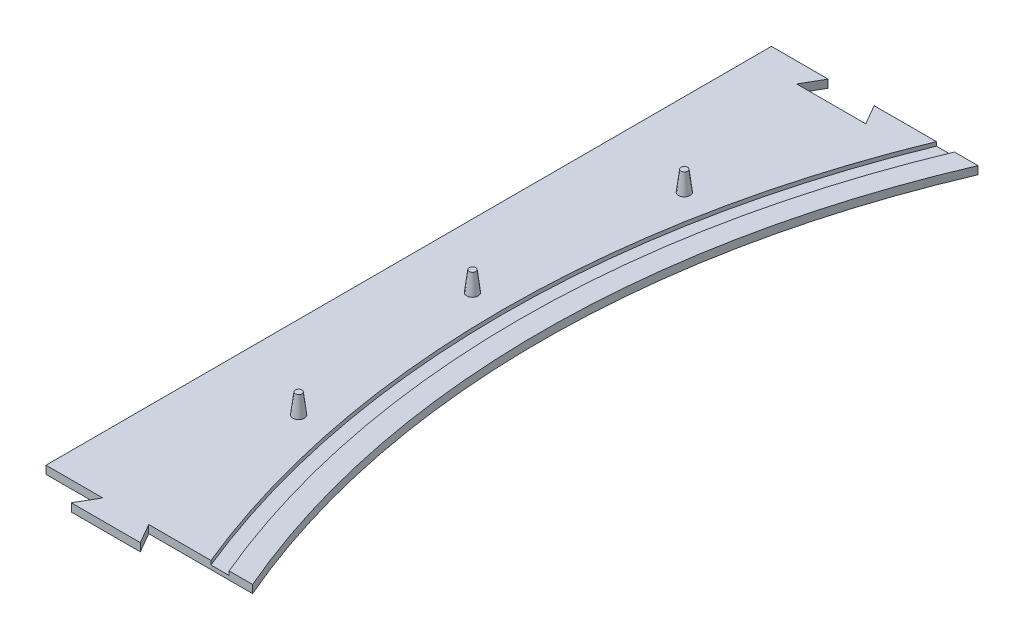
from build123d import *

# Parameters (mm, degrees)
BASEPLATE_PROFILE_DEPTH               = 2
SKETCH2_R                             = 1.45
M3_PINS_DEPTH                         = 5
M3_PINS_TAPER                         = 7
CIRPATTERN1_COUNT                     = 32
SKETCH4_R                             = 1
PILLAR_PINS_DEPTH                     = 5
PILLAR_PINS_DRAFT                     = 6
PILLAR_PINS_PROFILE_2_DEPTH           = 5
PILLAR_PINS_PROFILE_2_DRAFT           = 6
CIRPATTERN2_COPY_1_SKETCH_R           = 1
CIRPATTERN2_COPY_1_DEPTH              = 5
CIRPATTERN2_COPY_1_DRAFT              = 6
CIRPATTERN2_COPY_2_SKETCH_R           = 1
CIRPATTERN2_COPY_2_DEPTH              = 5
CIRPATTERN2_COPY_2_DRAFT              = 6
CIRPATTERN2_COPY_3_SKETCH_R           = 1
CIRPATTERN2_COPY_3_DEPTH              = 5
CIRPATTERN2_COPY_3_DRAFT              = 6
CIRPATTERN2_COPY_4_SKETCH_R           = 1
CIRPATTERN2_COPY_4_DEPTH              = 5
CIRPATTERN2_COPY_4_DRAFT              = 6
CIRPATTERN2_COPY_5_SKETCH_R           = 1
CIRPATTERN2_COPY_5_DEPTH              = 5
CIRPATTERN2_COPY_5_DRAFT              = 6
CIRPATTERN2_COPY_6_SKETCH_R           = 1
CIRPATTERN2_COPY_6_DEPTH              = 5
CIRPATTERN2_COPY_6_DRAFT              = 6
CIRPATTERN2_COPY_7_SKETCH_R           = 1
CIRPATTERN2_COPY_7_DEPTH              = 5
CIRPATTERN2_COPY_7_DRAFT              = 6
CIRPATTERN2_COPY_8_SKETCH_R           = 1
CIRPATTERN2_COPY_8_DEPTH              = 5
CIRPATTERN2_COPY_8_DRAFT              = 6
CIRPATTERN2_COPY_9_SKETCH_R           = 1
CIRPATTERN2_COPY_9_DEPTH              = 5
CIRPATTERN2_COPY_9_DRAFT              = 6
CIRPATTERN2_COPY_10_SKETCH_R          = 1
CIRPATTERN2_COPY_10_DEPTH             = 5
CIRPATTERN2_COPY_10_DRAFT             = 6
CIRPATTERN2_COPY_11_SKETCH_R          = 1
CIRPATTERN2_COPY_11_DEPTH             = 5
CIRPATTERN2_COPY_11_DRAFT             = 6
CIRPATTERN2_COPY_12_SKETCH_R          = 1
CIRPATTERN2_COPY_12_DEPTH             = 5
CIRPATTERN2_COPY_12_DRAFT             = 6
CIRPATTERN2_COPY_13_SKETCH_R          = 1
CIRPATTERN2_COPY_13_DEPTH             = 5
CIRPATTERN2_COPY_13_DRAFT             = 6
CIRPATTERN2_COPY_14_SKETCH_R          = 1
CIRPATTERN2_COPY_14_DEPTH             = 5
CIRPATTERN2_COPY_14_DRAFT             = 6
CIRPATTERN2_COPY_15_SKETCH_R          = 1
CIRPATTERN2_COPY_15_DEPTH             = 5
CIRPATTERN2_COPY_15_DRAFT             = 6
SKETCH5_R                             = 3
M8_HOLE_1_DEPTH                       = 5
M8_HOLE_1_TAPER                       = 12
M8_1_PATTERN_COUNT                    = 4
SKETCH6_R                             = 3
EXTRUDE_M8_2_DEPTH                    = 5
EXTRUDE_M8_2_TAPER                    = 12
M8_2_PATTERN_COUNT                    = 4
PATTERN_CIRCULAR_M8_3_COUNT           = 2
PATTERN_CIRCULAR_M8_3_ANGLE           = 36.9
PATTERN_CIRCULAR_M8_3_COPY_1_SKETCH_R = 3
PATTERN_CIRCULAR_M8_3_COPY_1_DEPTH    = 5
PATTERN_CIRCULAR_M8_3_COPY_1_TAPER    = 12
PATTERN_CIRCULAR_M8_3_COPY_2_SKETCH_R = 3
PATTERN_CIRCULAR_M8_3_COPY_2_DEPTH    = 5
PATTERN_CIRCULAR_M8_3_COPY_2_TAPER    = 12
PATTERN_CIRCULAR_M8_3_COPY_3_SKETCH_R = 3
PATTERN_CIRCULAR_M8_3_COPY_3_DEPTH    = 5
PATTERN_CIRCULAR_M8_3_COPY_3_TAPER    = 12
CUT_CENTER_DEPTH                      = 374.385859402
CIRPATTERN7_COUNT                     = 6
SKETCH12_W                            = 610.181250352
SKETCH12_H                            = 664.04441738
SKETCH12_W_2                          = 90
SKETCH12_H_2                          = 182
CUT_EXTRUDE1_DEPTH                    = 10
BOSS_EXTRUDE1_DEPTH                   = 2
CUT_EXTRUDE2_DEPTH                    = 2
SKETCH15_R                            = 240.5
SKETCH15_R_2                          = 236.3
ORING_SPACE_DEPTH                     = 1


with BuildPart() as part:
    # Sketch1 → baseplate profile (new body)
    with BuildSketch(Plane(origin=(0, 0, 0), x_dir=(1, 0, 0), z_dir=(0, 1, 0))):
        Polygon((264, 0), (264, 131.98), (131.979594929, 264), (0, 264), (-131.98, 264), (-264, 131.979594929), (-264, 0), (-264, -131.98), (-131.979594929, -264), (0, -264), (131.98, -264), (264, -131.979594929), align=None)
    extrude(amount=-BASEPLATE_PROFILE_DEPTH)

    # Sketch2 → M3 pins (add)
    with BuildSketch(Plane(origin=(0, 0, 0), x_dir=(1, 0, 0), z_dir=(0, 1, 0))):
        with Locations((0, 248)):
            Circle(SKETCH2_R)
    m3_pins = extrude(amount=M3_PINS_DEPTH, taper=M3_PINS_TAPER)

    # CirPattern1: M3 pins ×32 about axis
    cirpattern1_axis = Axis((0, 0, 0), (0, 1, 0))
    for i in range(1, CIRPATTERN1_COUNT):
        add(m3_pins.rotate(cirpattern1_axis, i * 360 / CIRPATTERN1_COUNT))


with BuildPart() as pillar_pins_tool:
    # Sketch4 → pillar pins (with draft: the straight prism first)
    with BuildSketch(Plane(origin=(0, 0, 0), x_dir=(1, 0, 0), z_dir=(0, 1, 0))):
        with Locations((9, 201)):
            Circle(SKETCH4_R)
    extrude(amount=PILLAR_PINS_DEPTH)
    # pillar pins: the draft: its side faces are tilted about the plane it starts from
    pillar_pins_sides = [pillar_pins_tool.faces().sort_by_distance(p)[0] for p in [
        (8, 2.5, -201),
    ]]
    draft(pillar_pins_sides, Plane(origin=(0, 0, 0), x_dir=(1, 0, 0), z_dir=(0, 1, 0)), PILLAR_PINS_DRAFT)


with BuildPart() as part_1:
    add(part.part)

    # pillar pins: add pillar_pins_tool
    add(pillar_pins_tool.part)


with BuildPart() as pillar_pins_profile_2_tool:
    # Sketch4 → pillar pins profile 2 (with draft: the straight prism first)
    with BuildSketch(Plane(origin=(0, 0, 0), x_dir=(1, 0, 0), z_dir=(0, 1, 0))):
        with Locations((-9, 201)):
            Circle(SKETCH4_R)
    extrude(amount=PILLAR_PINS_PROFILE_2_DEPTH)
    # pillar pins profile 2: the draft: its side faces are tilted about the plane it starts from
    pillar_pins_profile_2_sides = [pillar_pins_profile_2_tool.faces().sort_by_distance(p)[0] for p in [
        (-10, 2.5, -201),
    ]]
    draft(pillar_pins_profile_2_sides, Plane(origin=(0, 0, 0), x_dir=(1, 0, 0), z_dir=(0, 1, 0)), PILLAR_PINS_PROFILE_2_DRAFT)


with BuildPart() as part_2:
    add(part_1.part)

    # pillar pins profile 2: add pillar_pins_profile_2_tool
    add(pillar_pins_profile_2_tool.part)


with BuildPart() as cirpattern2_copy_1_tool:
    # CirPattern2 copy 1 sketch → CirPattern2 copy 1 (with draft: the straight prism first)
    with BuildSketch(Plane(origin=(0, 0, 0), x_dir=(0.5000000000000001, 0, -0.8660254037844386), z_dir=(0, 1, 0))):
        with Locations((9, 201)):
            Circle(CIRPATTERN2_COPY_1_SKETCH_R)
    extrude(amount=CIRPATTERN2_COPY_1_DEPTH)
    # CirPattern2 copy 1: the draft: its side faces are tilted about the plane it starts from
    cirpattern2_copy_1_sides = [cirpattern2_copy_1_tool.faces().sort_by_distance(p)[0] for p in [
        (-170.071106161, 2.5, -107.42820323),
    ]]
    draft(cirpattern2_copy_1_sides, Plane(origin=(0, 0, 0), x_dir=(0.5000000000000001, 0, -0.8660254037844386), z_dir=(0, 1, 0)), CIRPATTERN2_COPY_1_DRAFT)


with BuildPart() as part_3:
    add(part_2.part)

    # CirPattern2 copy 1: add cirpattern2_copy_1_tool
    add(cirpattern2_copy_1_tool.part)


with BuildPart() as cirpattern2_copy_2_tool:
    # CirPattern2 copy 2 sketch → CirPattern2 copy 2 (with draft: the straight prism first)
    with BuildSketch(Plane(origin=(0, 0, 0), x_dir=(-0.4999999999999998, 0, -0.8660254037844387), z_dir=(0, 1, 0))):
        with Locations((9, 201)):
            Circle(CIRPATTERN2_COPY_2_SKETCH_R)
    extrude(amount=CIRPATTERN2_COPY_2_DEPTH)
    # CirPattern2 copy 2: the draft: its side faces are tilted about the plane it starts from
    cirpattern2_copy_2_sides = [cirpattern2_copy_2_tool.faces().sort_by_distance(p)[0] for p in [
        (-178.071106161, 2.5, 93.57179677),
    ]]
    draft(cirpattern2_copy_2_sides, Plane(origin=(0, 0, 0), x_dir=(-0.4999999999999998, 0, -0.8660254037844387), z_dir=(0, 1, 0)), CIRPATTERN2_COPY_2_DRAFT)


with BuildPart() as part_4:
    add(part_3.part)

    # CirPattern2 copy 2: add cirpattern2_copy_2_tool
    add(cirpattern2_copy_2_tool.part)


with BuildPart() as cirpattern2_copy_3_tool:
    # CirPattern2 copy 3 sketch → CirPattern2 copy 3 (with draft: the straight prism first)
    with BuildSketch(Plane(origin=(0, 0, 0), x_dir=(-1, 0, 0), z_dir=(0, 1, 0))):
        with Locations((9, 201)):
            Circle(CIRPATTERN2_COPY_3_SKETCH_R)
    extrude(amount=CIRPATTERN2_COPY_3_DEPTH)
    # CirPattern2 copy 3: the draft: its side faces are tilted about the plane it starts from
    cirpattern2_copy_3_sides = [cirpattern2_copy_3_tool.faces().sort_by_distance(p)[0] for p in [
        (-8, 2.5, 201),
    ]]
    draft(cirpattern2_copy_3_sides, Plane(origin=(0, 0, 0), x_dir=(-1, 0, 0), z_dir=(0, 1, 0)), CIRPATTERN2_COPY_3_DRAFT)


with BuildPart() as part_5:
    add(part_4.part)

    # CirPattern2 copy 3: add cirpattern2_copy_3_tool
    add(cirpattern2_copy_3_tool.part)


with BuildPart() as cirpattern2_copy_4_tool:
    # CirPattern2 copy 4 sketch → CirPattern2 copy 4 (with draft: the straight prism first)
    with BuildSketch(Plane(origin=(0, 0, 0), x_dir=(-0.5000000000000004, 0, 0.8660254037844384), z_dir=(0, 1, 0))):
        with Locations((9, 201)):
            Circle(CIRPATTERN2_COPY_4_SKETCH_R)
    extrude(amount=CIRPATTERN2_COPY_4_DEPTH)
    # CirPattern2 copy 4: the draft: its side faces are tilted about the plane it starts from
    cirpattern2_copy_4_sides = [cirpattern2_copy_4_tool.faces().sort_by_distance(p)[0] for p in [
        (170.071106161, 2.5, 107.42820323),
    ]]
    draft(cirpattern2_copy_4_sides, Plane(origin=(0, 0, 0), x_dir=(-0.5000000000000004, 0, 0.8660254037844384), z_dir=(0, 1, 0)), CIRPATTERN2_COPY_4_DRAFT)


with BuildPart() as part_6:
    add(part_5.part)

    # CirPattern2 copy 4: add cirpattern2_copy_4_tool
    add(cirpattern2_copy_4_tool.part)


with BuildPart() as cirpattern2_copy_5_tool:
    # CirPattern2 copy 5 sketch → CirPattern2 copy 5 (with draft: the straight prism first)
    with BuildSketch(Plane(origin=(0, 0, 0), x_dir=(0.5000000000000001, 0, 0.8660254037844386), z_dir=(0, 1, 0))):
        with Locations((9, 201)):
            Circle(CIRPATTERN2_COPY_5_SKETCH_R)
    extrude(amount=CIRPATTERN2_COPY_5_DEPTH)
    # CirPattern2 copy 5: the draft: its side faces are tilted about the plane it starts from
    cirpattern2_copy_5_sides = [cirpattern2_copy_5_tool.faces().sort_by_distance(p)[0] for p in [
        (178.071106161, 2.5, -93.57179677),
    ]]
    draft(cirpattern2_copy_5_sides, Plane(origin=(0, 0, 0), x_dir=(0.5000000000000001, 0, 0.8660254037844386), z_dir=(0, 1, 0)), CIRPATTERN2_COPY_5_DRAFT)


with BuildPart() as part_7:
    add(part_6.part)

    # CirPattern2 copy 5: add cirpattern2_copy_5_tool
    add(cirpattern2_copy_5_tool.part)


with BuildPart() as cirpattern2_copy_6_tool:
    # CirPattern2 copy 6 sketch → CirPattern2 copy 6 (with draft: the straight prism first)
    with BuildSketch(Plane(origin=(0, 0, 0), x_dir=(0.5000000000000001, 0, -0.8660254037844386), z_dir=(0, 1, 0))):
        with Locations((-9, 201)):
            Circle(CIRPATTERN2_COPY_6_SKETCH_R)
    extrude(amount=CIRPATTERN2_COPY_6_DEPTH)
    # CirPattern2 copy 6: the draft: its side faces are tilted about the plane it starts from
    cirpattern2_copy_6_sides = [cirpattern2_copy_6_tool.faces().sort_by_distance(p)[0] for p in [
        (-179.071106161, 2.5, -91.839745962),
    ]]
    draft(cirpattern2_copy_6_sides, Plane(origin=(0, 0, 0), x_dir=(0.5000000000000001, 0, -0.8660254037844386), z_dir=(0, 1, 0)), CIRPATTERN2_COPY_6_DRAFT)


with BuildPart() as part_8:
    add(part_7.part)

    # CirPattern2 copy 6: add cirpattern2_copy_6_tool
    add(cirpattern2_copy_6_tool.part)


with BuildPart() as cirpattern2_copy_7_tool:
    # CirPattern2 copy 7 sketch → CirPattern2 copy 7 (with draft: the straight prism first)
    with BuildSketch(Plane(origin=(0, 0, 0), x_dir=(-0.4999999999999998, 0, -0.8660254037844387), z_dir=(0, 1, 0))):
        with Locations((-9, 201)):
            Circle(CIRPATTERN2_COPY_7_SKETCH_R)
    extrude(amount=CIRPATTERN2_COPY_7_DEPTH)
    # CirPattern2 copy 7: the draft: its side faces are tilted about the plane it starts from
    cirpattern2_copy_7_sides = [cirpattern2_copy_7_tool.faces().sort_by_distance(p)[0] for p in [
        (-169.071106161, 2.5, 109.160254038),
    ]]
    draft(cirpattern2_copy_7_sides, Plane(origin=(0, 0, 0), x_dir=(-0.4999999999999998, 0, -0.8660254037844387), z_dir=(0, 1, 0)), CIRPATTERN2_COPY_7_DRAFT)


with BuildPart() as part_9:
    add(part_8.part)

    # CirPattern2 copy 7: add cirpattern2_copy_7_tool
    add(cirpattern2_copy_7_tool.part)


with BuildPart() as cirpattern2_copy_8_tool:
    # CirPattern2 copy 8 sketch → CirPattern2 copy 8 (with draft: the straight prism first)
    with BuildSketch(Plane(origin=(0, 0, 0), x_dir=(-1, 0, 0), z_dir=(0, 1, 0))):
        with Locations((-9, 201)):
            Circle(CIRPATTERN2_COPY_8_SKETCH_R)
    extrude(amount=CIRPATTERN2_COPY_8_DEPTH)
    # CirPattern2 copy 8: the draft: its side faces are tilted about the plane it starts from
    cirpattern2_copy_8_sides = [cirpattern2_copy_8_tool.faces().sort_by_distance(p)[0] for p in [
        (10, 2.5, 201),
    ]]
    draft(cirpattern2_copy_8_sides, Plane(origin=(0, 0, 0), x_dir=(-1, 0, 0), z_dir=(0, 1, 0)), CIRPATTERN2_COPY_8_DRAFT)


with BuildPart() as part_10:
    add(part_9.part)

    # CirPattern2 copy 8: add cirpattern2_copy_8_tool
    add(cirpattern2_copy_8_tool.part)


with BuildPart() as cirpattern2_copy_9_tool:
    # CirPattern2 copy 9 sketch → CirPattern2 copy 9 (with draft: the straight prism first)
    with BuildSketch(Plane(origin=(0, 0, 0), x_dir=(-0.5000000000000004, 0, 0.8660254037844384), z_dir=(0, 1, 0))):
        with Locations((-9, 201)):
            Circle(CIRPATTERN2_COPY_9_SKETCH_R)
    extrude(amount=CIRPATTERN2_COPY_9_DEPTH)
    # CirPattern2 copy 9: the draft: its side faces are tilted about the plane it starts from
    cirpattern2_copy_9_sides = [cirpattern2_copy_9_tool.faces().sort_by_distance(p)[0] for p in [
        (179.071106161, 2.5, 91.839745962),
    ]]
    draft(cirpattern2_copy_9_sides, Plane(origin=(0, 0, 0), x_dir=(-0.5000000000000004, 0, 0.8660254037844384), z_dir=(0, 1, 0)), CIRPATTERN2_COPY_9_DRAFT)


with BuildPart() as part_11:
    add(part_10.part)

    # CirPattern2 copy 9: add cirpattern2_copy_9_tool
    add(cirpattern2_copy_9_tool.part)


with BuildPart() as cirpattern2_copy_10_tool:
    # CirPattern2 copy 10 sketch → CirPattern2 copy 10 (with draft: the straight prism first)
    with BuildSketch(Plane(origin=(0, 0, 0), x_dir=(0.5000000000000001, 0, 0.8660254037844386), z_dir=(0, 1, 0))):
        with Locations((-9, 201)):
            Circle(CIRPATTERN2_COPY_10_SKETCH_R)
    extrude(amount=CIRPATTERN2_COPY_10_DEPTH)
    # CirPattern2 copy 10: the draft: its side faces are tilted about the plane it starts from
    cirpattern2_copy_10_sides = [cirpattern2_copy_10_tool.faces().sort_by_distance(p)[0] for p in [
        (169.071106161, 2.5, -109.160254038),
    ]]
    draft(cirpattern2_copy_10_sides, Plane(origin=(0, 0, 0), x_dir=(0.5000000000000001, 0, 0.8660254037844386), z_dir=(0, 1, 0)), CIRPATTERN2_COPY_10_DRAFT)


with BuildPart() as part_12:
    add(part_11.part)

    # CirPattern2 copy 10: add cirpattern2_copy_10_tool
    add(cirpattern2_copy_10_tool.part)


with BuildPart() as cirpattern2_copy_11_tool:
    # CirPattern2 copy 11 sketch → CirPattern2 copy 11 (with draft: the straight prism first)
    with BuildSketch(Plane(origin=(0, 0, 0), x_dir=(0.5000000000000001, 0, -0.8660254037844386), z_dir=(0, 1, 0))):
        with Locations((-9, 201)):
            Circle(CIRPATTERN2_COPY_11_SKETCH_R)
    extrude(amount=CIRPATTERN2_COPY_11_DEPTH)
    # CirPattern2 copy 11: the draft: its side faces are tilted about the plane it starts from
    cirpattern2_copy_11_sides = [cirpattern2_copy_11_tool.faces().sort_by_distance(p)[0] for p in [
        (-179.071106161, 2.5, -91.839745962),
    ]]
    draft(cirpattern2_copy_11_sides, Plane(origin=(0, 0, 0), x_dir=(0.5000000000000001, 0, -0.8660254037844386), z_dir=(0, 1, 0)), CIRPATTERN2_COPY_11_DRAFT)


with BuildPart() as part_13:
    add(part_12.part)

    # CirPattern2 copy 11: add cirpattern2_copy_11_tool
    add(cirpattern2_copy_11_tool.part)


with BuildPart() as cirpattern2_copy_12_tool:
    # CirPattern2 copy 12 sketch → CirPattern2 copy 12 (with draft: the straight prism first)
    with BuildSketch(Plane(origin=(0, 0, 0), x_dir=(-0.4999999999999998, 0, -0.8660254037844387), z_dir=(0, 1, 0))):
        with Locations((-9, 201)):
            Circle(CIRPATTERN2_COPY_12_SKETCH_R)
    extrude(amount=CIRPATTERN2_COPY_12_DEPTH)
    # CirPattern2 copy 12: the draft: its side faces are tilted about the plane it starts from
    cirpattern2_copy_12_sides = [cirpattern2_copy_12_tool.faces().sort_by_distance(p)[0] for p in [
        (-169.071106161, 2.5, 109.160254038),
    ]]
    draft(cirpattern2_copy_12_sides, Plane(origin=(0, 0, 0), x_dir=(-0.4999999999999998, 0, -0.8660254037844387), z_dir=(0, 1, 0)), CIRPATTERN2_COPY_12_DRAFT)


with BuildPart() as part_14:
    add(part_13.part)

    # CirPattern2 copy 12: add cirpattern2_copy_12_tool
    add(cirpattern2_copy_12_tool.part)


with BuildPart() as cirpattern2_copy_13_tool:
    # CirPattern2 copy 13 sketch → CirPattern2 copy 13 (with draft: the straight prism first)
    with BuildSketch(Plane(origin=(0, 0, 0), x_dir=(-1, 0, 0), z_dir=(0, 1, 0))):
        with Locations((-9, 201)):
            Circle(CIRPATTERN2_COPY_13_SKETCH_R)
    extrude(amount=CIRPATTERN2_COPY_13_DEPTH)
    # CirPattern2 copy 13: the draft: its side faces are tilted about the plane it starts from
    cirpattern2_copy_13_sides = [cirpattern2_copy_13_tool.faces().sort_by_distance(p)[0] for p in [
        (10, 2.5, 201),
    ]]
    draft(cirpattern2_copy_13_sides, Plane(origin=(0, 0, 0), x_dir=(-1, 0, 0), z_dir=(0, 1, 0)), CIRPATTERN2_COPY_13_DRAFT)


with BuildPart() as part_15:
    add(part_14.part)

    # CirPattern2 copy 13: add cirpattern2_copy_13_tool
    add(cirpattern2_copy_13_tool.part)


with BuildPart() as cirpattern2_copy_14_tool:
    # CirPattern2 copy 14 sketch → CirPattern2 copy 14 (with draft: the straight prism first)
    with BuildSketch(Plane(origin=(0, 0, 0), x_dir=(-0.5000000000000004, 0, 0.8660254037844384), z_dir=(0, 1, 0))):
        with Locations((-9, 201)):
            Circle(CIRPATTERN2_COPY_14_SKETCH_R)
    extrude(amount=CIRPATTERN2_COPY_14_DEPTH)
    # CirPattern2 copy 14: the draft: its side faces are tilted about the plane it starts from
    cirpattern2_copy_14_sides = [cirpattern2_copy_14_tool.faces().sort_by_distance(p)[0] for p in [
        (179.071106161, 2.5, 91.839745962),
    ]]
    draft(cirpattern2_copy_14_sides, Plane(origin=(0, 0, 0), x_dir=(-0.5000000000000004, 0, 0.8660254037844384), z_dir=(0, 1, 0)), CIRPATTERN2_COPY_14_DRAFT)


with BuildPart() as part_16:
    add(part_15.part)

    # CirPattern2 copy 14: add cirpattern2_copy_14_tool
    add(cirpattern2_copy_14_tool.part)


with BuildPart() as cirpattern2_copy_15_tool:
    # CirPattern2 copy 15 sketch → CirPattern2 copy 15 (with draft: the straight prism first)
    with BuildSketch(Plane(origin=(0, 0, 0), x_dir=(0.5000000000000001, 0, 0.8660254037844386), z_dir=(0, 1, 0))):
        with Locations((-9, 201)):
            Circle(CIRPATTERN2_COPY_15_SKETCH_R)
    extrude(amount=CIRPATTERN2_COPY_15_DEPTH)
    # CirPattern2 copy 15: the draft: its side faces are tilted about the plane it starts from
    cirpattern2_copy_15_sides = [cirpattern2_copy_15_tool.faces().sort_by_distance(p)[0] for p in [
        (169.071106161, 2.5, -109.160254038),
    ]]
    draft(cirpattern2_copy_15_sides, Plane(origin=(0, 0, 0), x_dir=(0.5000000000000001, 0, 0.8660254037844386), z_dir=(0, 1, 0)), CIRPATTERN2_COPY_15_DRAFT)


with BuildPart() as part_17:
    add(part_16.part)

    # CirPattern2 copy 15: add cirpattern2_copy_15_tool
    add(cirpattern2_copy_15_tool.part)

    # Sketch5 → M8 hole -1 (add)
    with BuildSketch(Plane(origin=(0, 0, 0), x_dir=(1, 0, 0), z_dir=(0, 1, 0))):
        with Locations((-193.040151264, 193.040151264)):
            Circle(SKETCH5_R)
    m8_hole_1 = extrude(amount=M8_HOLE_1_DEPTH, taper=M8_HOLE_1_TAPER)

    # M8 -1 pattern: M8 hole -1 ×4 about axis
    m8_1_pattern_axis = Axis((0, 0, 0), (0, 1, 0))
    for i in range(1, M8_1_PATTERN_COUNT):
        add(m8_hole_1.rotate(m8_1_pattern_axis, i * 360 / M8_1_PATTERN_COUNT))

    # Sketch6 → M8 -2 (add)
    with BuildSketch(Plane(origin=(0, 0, 0), x_dir=(1, 0, 0), z_dir=(0, 1, 0))):
        with Locations((-125, -250)):
            Circle(SKETCH6_R)
    extrude_m8_2 = extrude(amount=EXTRUDE_M8_2_DEPTH, taper=EXTRUDE_M8_2_TAPER)

    # M8 -2 pattern: M8 -2 ×4 about axis
    m8_2_pattern_axis = Axis((0, 0, 0), (0, 1, 0))
    for i in range(1, M8_2_PATTERN_COUNT):
        add(extrude_m8_2.rotate(m8_2_pattern_axis, i * 360 / M8_2_PATTERN_COUNT))

    # M8 -3: M8 -2 ×2 about axis
    pattern_circular_m8_3_axis = Axis((0, 0, 0), (0, -1, 0))
    for i in range(1, PATTERN_CIRCULAR_M8_3_COUNT):
        add(extrude_m8_2.rotate(pattern_circular_m8_3_axis, i * PATTERN_CIRCULAR_M8_3_ANGLE / (PATTERN_CIRCULAR_M8_3_COUNT - 1)))

    # M8 -3 copy 1 sketch → M8 -3 copy 1 (add)
    with BuildSketch(Plane(origin=(0, 0, 0), x_dir=(0.6004202253258852, 0, -0.7996846584870897), z_dir=(0, 1, 0))):
        with Locations((-125, -250)):
            Circle(PATTERN_CIRCULAR_M8_3_COPY_1_SKETCH_R)
    extrude(amount=PATTERN_CIRCULAR_M8_3_COPY_1_DEPTH, taper=PATTERN_CIRCULAR_M8_3_COPY_1_TAPER)

    # M8 -3 copy 2 sketch → M8 -3 copy 2 (add)
    with BuildSketch(Plane(origin=(0, 0, 0), x_dir=(-0.7996846584870896, 0, -0.6004202253258853), z_dir=(0, 1, 0))):
        with Locations((-125, -250)):
            Circle(PATTERN_CIRCULAR_M8_3_COPY_2_SKETCH_R)
    extrude(amount=PATTERN_CIRCULAR_M8_3_COPY_2_DEPTH, taper=PATTERN_CIRCULAR_M8_3_COPY_2_TAPER)

    # M8 -3 copy 3 sketch → M8 -3 copy 3 (add)
    with BuildSketch(Plane(origin=(0, 0, 0), x_dir=(-0.6004202253258853, 0, 0.7996846584870896), z_dir=(0, 1, 0))):
        with Locations((-125, -250)):
            Circle(PATTERN_CIRCULAR_M8_3_COPY_3_SKETCH_R)
    extrude(amount=PATTERN_CIRCULAR_M8_3_COPY_3_DEPTH, taper=PATTERN_CIRCULAR_M8_3_COPY_3_TAPER)

    # Sketch8 → cut center (cut, through all)
    with BuildSketch(Plane(origin=(0, 0, 0), x_dir=(1, 0, 0), z_dir=(0, 1, 0))):
        with BuildLine():
            Line((115.433963806, -199.937490231), (0, 0))
            Line((0, 0), (0, -180))
            Line((0, -180), (20, -180))
            Line((20, -180), (20, -230))
            ThreePointArc((20, -230), (69.365180469, -220.200980331), (115.433963806, -199.937490231))
        make_face()
        with BuildLine():
            Line((0, -180), (0, 0))
            Line((0, 0), (-115.433963806, -199.937490231))
            ThreePointArc((-115.433963806, -199.937490231), (-69.365180469, -220.200980331), (-20, -230))
            Line((-20, -230), (-20, -180))
            Line((-20, -180), (0, -180))
        make_face()
    cut_center = extrude(amount=-CUT_CENTER_DEPTH, mode=Mode.SUBTRACT)

    # CirPattern7: cut center ×6 about axis
    cirpattern7_axis = Axis((0, 0, 0), (0, 1, 0))
    for i in range(1, CIRPATTERN7_COUNT):
        add(cut_center.rotate(cirpattern7_axis, i * 360 / CIRPATTERN7_COUNT), mode=Mode.SUBTRACT)

    # Sketch12 → Cut-Extrude1 (cut)
    with BuildSketch(Plane.XZ.offset(2)):
        with Locations((-1.205891799, -1.607855732)):
            Rectangle(SKETCH12_W, SKETCH12_H)
        with Locations((-245, 0)):
            Rectangle(SKETCH12_W_2, SKETCH12_H_2, mode=Mode.SUBTRACT)
    extrude(amount=-CUT_EXTRUDE1_DEPTH, mode=Mode.SUBTRACT)

    # Sketch13 → Boss-Extrude1 (add)
    with BuildSketch(Plane(origin=(0, 0, 0), x_dir=(1, 0, 0), z_dir=(0, 1, 0))):
        Polygon((-252.660254038, -96), (-235.339745962, -96), (-244, -81), align=None)
    extrude(amount=-BOSS_EXTRUDE1_DEPTH)

    # Sketch14 → Cut-Extrude2 (cut)
    with BuildSketch(Plane(origin=(0, 0, 0), x_dir=(1, 0, 0), z_dir=(0, 1, 0))):
        Polygon((-252.660254038, 86), (-235.339745962, 86), (-244, 101), align=None)
    extrude(amount=-CUT_EXTRUDE2_DEPTH, mode=Mode.SUBTRACT)

    # Sketch15 → oring space (cut)
    with BuildSketch(Plane(origin=(0, 0, 0), x_dir=(1, 0, 0), z_dir=(0, 1, 0))):
        Circle(SKETCH15_R)
        Circle(SKETCH15_R_2, mode=Mode.SUBTRACT)
    extrude(amount=-ORING_SPACE_DEPTH, mode=Mode.SUBTRACT)


solid = part_17.part
